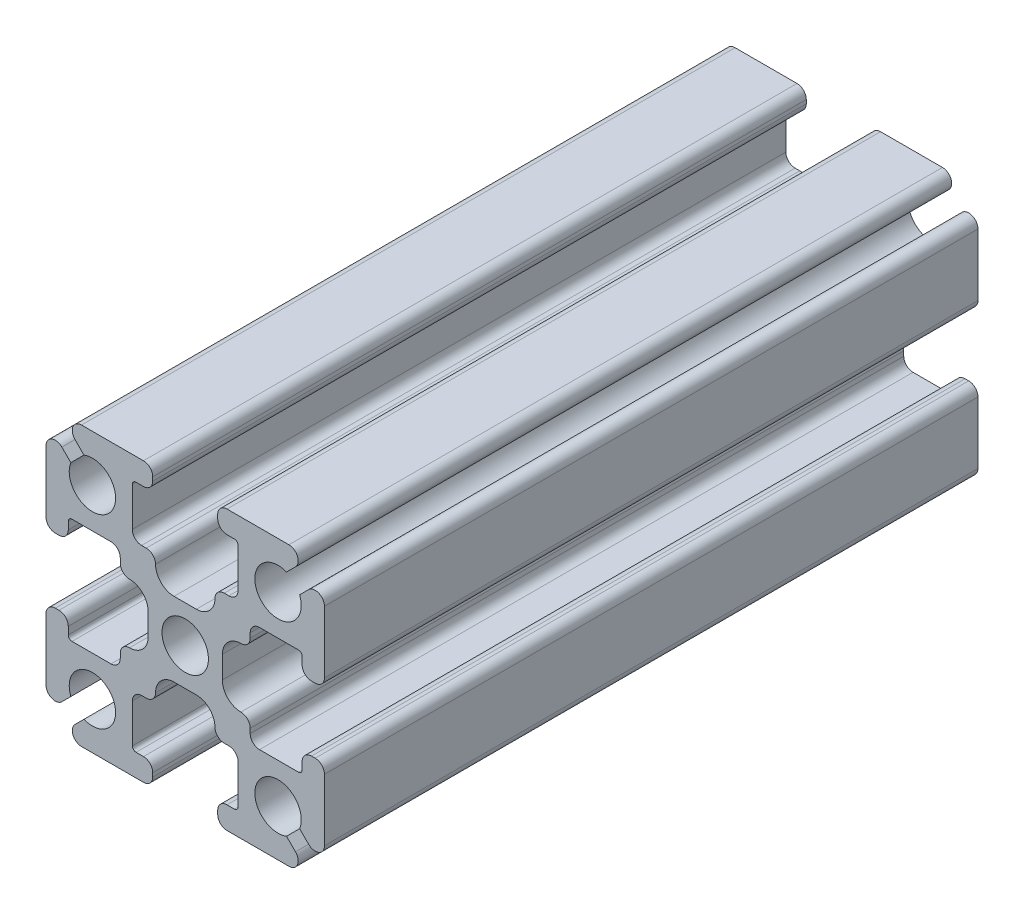
from build123d import *

# Parameters (mm, degrees)
SKETCH1_R           = 1.25
BOSS_EXTRUDE1_DEPTH = 35.204999976


with BuildPart() as part:
    # Sketch1 → Boss-Extrude1 (new body)
    with BuildSketch(Plane.XY):
        with BuildLine():
            Line((6.646446609, 5.939339828), (6.163645978, 5.456539197))
            ThreePointArc((6.163645978, 5.456539197), (4.116116524, 4.116116524), (5.456539197, 6.163645978))
            Line((5.456539197, 6.163645978), (5.939339828, 6.646446609))
            ThreePointArc((5.939339828, 6.646446609), (6.047726204, 7.191341716), (5.585786438, 7.5))
            Line((5.585786438, 7.5), (2.25, 7.5))
            ThreePointArc((2.25, 7.5), (1.896446609, 7.353553391), (1.75, 7))
            Line((1.75, 7), (1.75, 6.8))
            ThreePointArc((1.75, 6.8), (1.896446609, 6.446446609), (2.25, 6.3))
            Line((2.25, 6.3), (2.65, 6.3))
            ThreePointArc((2.65, 6.3), (2.791421356, 6.241421356), (2.85, 6.1))
            Line((2.85, 6.1), (2.85, 4))
            ThreePointArc((2.85, 4), (2.703553391, 3.646446609), (2.35, 3.5))
            Line((2.35, 3.5), (2.1, 3.5))
            ThreePointArc((2.1, 3.5), (1.746446609, 3.353553391), (1.6, 3))
            ThreePointArc((1.6, 3), (1.307106781, 2.292893219), (0.6, 2))
            Line((0.6, 2), (-0.6, 2))
            ThreePointArc((-0.6, 2), (-1.307106781, 2.292893219), (-1.6, 3))
            ThreePointArc((-1.6, 3), (-1.746446609, 3.353553391), (-2.1, 3.5))
            Line((-2.1, 3.5), (-2.35, 3.5))
            ThreePointArc((-2.35, 3.5), (-2.703553391, 3.646446609), (-2.85, 4))
            Line((-2.85, 4), (-2.85, 6.1))
            ThreePointArc((-2.85, 6.1), (-2.791421356, 6.241421356), (-2.65, 6.3))
            Line((-2.65, 6.3), (-2.25, 6.3))
            ThreePointArc((-2.25, 6.3), (-1.896446609, 6.446446609), (-1.75, 6.8))
            Line((-1.75, 6.8), (-1.75, 7))
            ThreePointArc((-1.75, 7), (-1.896446609, 7.353553391), (-2.25, 7.5))
            Line((-2.25, 7.5), (-5.585786438, 7.5))
            ThreePointArc((-5.585786438, 7.5), (-6.047726204, 7.191341716), (-5.939339828, 6.646446609))
            Line((-5.939339828, 6.646446609), (-5.456539197, 6.163645978))
            ThreePointArc((-5.456539197, 6.163645978), (-4.116116524, 4.116116524), (-6.163645978, 5.456539197))
            Line((-6.163645978, 5.456539197), (-6.646446609, 5.939339828))
            ThreePointArc((-6.646446609, 5.939339828), (-7.191341716, 6.047726204), (-7.5, 5.585786438))
            Line((-7.5, 5.585786438), (-7.5, 2.25))
            ThreePointArc((-7.5, 2.25), (-7.353553391, 1.896446609), (-7, 1.75))
            Line((-7, 1.75), (-6.8, 1.75))
            ThreePointArc((-6.8, 1.75), (-6.446446609, 1.896446609), (-6.3, 2.25))
            Line((-6.3, 2.25), (-6.3, 2.65))
            ThreePointArc((-6.3, 2.65), (-6.241421356, 2.791421356), (-6.1, 2.85))
            Line((-6.1, 2.85), (-4, 2.85))
            ThreePointArc((-4, 2.85), (-3.646446609, 2.703553391), (-3.5, 2.35))
            Line((-3.5, 2.35), (-3.5, 2.1))
            ThreePointArc((-3.5, 2.1), (-3.353553391, 1.746446609), (-3, 1.6))
            ThreePointArc((-3, 1.6), (-2.292893219, 1.307106781), (-2, 0.6))
            Line((-2, 0.6), (-2, -0.6))
            ThreePointArc((-2, -0.6), (-2.292893219, -1.307106781), (-3, -1.6))
            ThreePointArc((-3, -1.6), (-3.353553391, -1.746446609), (-3.5, -2.1))
            Line((-3.5, -2.1), (-3.5, -2.35))
            ThreePointArc((-3.5, -2.35), (-3.646446609, -2.703553391), (-4, -2.85))
            Line((-4, -2.85), (-6.1, -2.85))
            ThreePointArc((-6.1, -2.85), (-6.241421356, -2.791421356), (-6.3, -2.65))
            Line((-6.3, -2.65), (-6.3, -2.25))
            ThreePointArc((-6.3, -2.25), (-6.446446609, -1.896446609), (-6.8, -1.75))
            Line((-6.8, -1.75), (-7, -1.75))
            ThreePointArc((-7, -1.75), (-7.353553391, -1.896446609), (-7.5, -2.25))
            Line((-7.5, -2.25), (-7.5, -5.585786438))
            ThreePointArc((-7.5, -5.585786438), (-7.191341716, -6.047726204), (-6.646446609, -5.939339828))
            Line((-6.646446609, -5.939339828), (-6.163645978, -5.456539197))
            ThreePointArc((-6.163645978, -5.456539197), (-4.116116524, -4.116116524), (-5.456539197, -6.163645978))
            Line((-5.456539197, -6.163645978), (-5.939339828, -6.646446609))
            ThreePointArc((-5.939339828, -6.646446609), (-6.047726204, -7.191341716), (-5.585786438, -7.5))
            Line((-5.585786438, -7.5), (-2.25, -7.5))
            ThreePointArc((-2.25, -7.5), (-1.896446609, -7.353553391), (-1.75, -7))
            Line((-1.75, -7), (-1.75, -6.8))
            ThreePointArc((-1.75, -6.8), (-1.896446609, -6.446446609), (-2.25, -6.3))
            Line((-2.25, -6.3), (-2.65, -6.3))
            ThreePointArc((-2.65, -6.3), (-2.791421356, -6.241421356), (-2.85, -6.1))
            Line((-2.85, -6.1), (-2.85, -4))
            ThreePointArc((-2.85, -4), (-2.703553391, -3.646446609), (-2.35, -3.5))
            Line((-2.35, -3.5), (-2.1, -3.5))
            ThreePointArc((-2.1, -3.5), (-1.746446609, -3.353553391), (-1.6, -3))
            ThreePointArc((-1.6, -3), (-1.307106781, -2.292893219), (-0.6, -2))
            Line((-0.6, -2), (0.6, -2))
            ThreePointArc((0.6, -2), (1.307106781, -2.292893219), (1.6, -3))
            ThreePointArc((1.6, -3), (1.746446609, -3.353553391), (2.1, -3.5))
            Line((2.1, -3.5), (2.35, -3.5))
            ThreePointArc((2.35, -3.5), (2.703553391, -3.646446609), (2.85, -4))
            Line((2.85, -4), (2.85, -6.1))
            ThreePointArc((2.85, -6.1), (2.791421356, -6.241421356), (2.65, -6.3))
            Line((2.65, -6.3), (2.25, -6.3))
            ThreePointArc((2.25, -6.3), (1.896446609, -6.446446609), (1.75, -6.8))
            Line((1.75, -6.8), (1.75, -7))
            ThreePointArc((1.75, -7), (1.896446609, -7.353553391), (2.25, -7.5))
            Line((2.25, -7.5), (5.585786438, -7.5))
            ThreePointArc((5.585786438, -7.5), (6.047726204, -7.191341716), (5.939339828, -6.646446609))
            Line((5.939339828, -6.646446609), (5.456539197, -6.163645978))
            ThreePointArc((5.456539197, -6.163645978), (4.116116524, -4.116116524), (6.163645978, -5.456539197))
            Line((6.163645978, -5.456539197), (6.646446609, -5.939339828))
            ThreePointArc((6.646446609, -5.939339828), (7.191341716, -6.047726204), (7.5, -5.585786438))
            Line((7.5, -5.585786438), (7.5, -2.25))
            ThreePointArc((7.5, -2.25), (7.353553391, -1.896446609), (7, -1.75))
            Line((7, -1.75), (6.8, -1.75))
            ThreePointArc((6.8, -1.75), (6.446446609, -1.896446609), (6.3, -2.25))
            Line((6.3, -2.25), (6.3, -2.65))
            ThreePointArc((6.3, -2.65), (6.241421356, -2.791421356), (6.1, -2.85))
            Line((6.1, -2.85), (4, -2.85))
            ThreePointArc((4, -2.85), (3.646446609, -2.703553391), (3.5, -2.35))
            Line((3.5, -2.35), (3.5, -2.1))
            ThreePointArc((3.5, -2.1), (3.353553391, -1.746446609), (3, -1.6))
            ThreePointArc((3, -1.6), (2.292893219, -1.307106781), (2, -0.6))
            Line((2, -0.6), (2, 0.6))
            ThreePointArc((2, 0.6), (2.292893219, 1.307106781), (3, 1.6))
            ThreePointArc((3, 1.6), (3.353553391, 1.746446609), (3.5, 2.1))
            Line((3.5, 2.1), (3.5, 2.35))
            ThreePointArc((3.5, 2.35), (3.646446609, 2.703553391), (4, 2.85))
            Line((4, 2.85), (6.1, 2.85))
            ThreePointArc((6.1, 2.85), (6.241421356, 2.791421356), (6.3, 2.65))
            Line((6.3, 2.65), (6.3, 2.25))
            ThreePointArc((6.3, 2.25), (6.446446609, 1.896446609), (6.8, 1.75))
            Line((6.8, 1.75), (7, 1.75))
            ThreePointArc((7, 1.75), (7.353553391, 1.896446609), (7.5, 2.25))
            Line((7.5, 2.25), (7.5, 5.585786438))
            ThreePointArc((7.5, 5.585786438), (7.191341716, 6.047726204), (6.646446609, 5.939339828))
        make_face()
        with Locations(Location((0, 0, 0), (0, 0, 180))):
            Circle(SKETCH1_R, mode=Mode.SUBTRACT)
    extrude(amount=BOSS_EXTRUDE1_DEPTH)


solid = part.part
